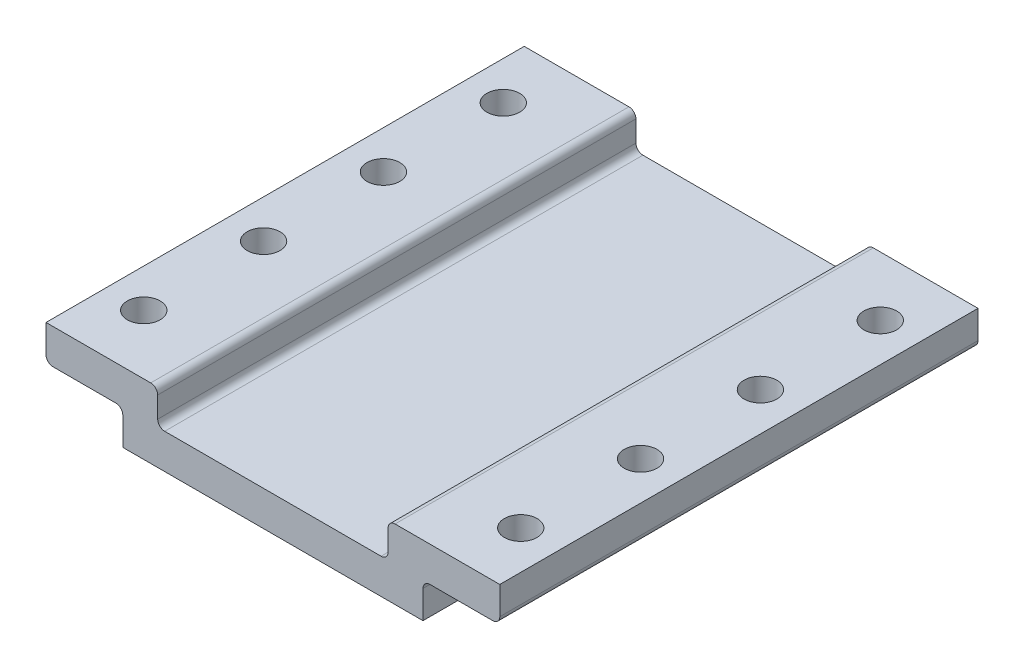
from build123d import *

# Parameters (mm, degrees)
SKETCH1_W           = 43
SKETCH1_H           = 68.5
BOSS_EXTRUDE1_DEPTH = 5
SKETCH2_W           = 16
SKETCH2_H           = 68.5
BOSS_EXTRUDE2_DEPTH = 5
CUT_EXTRUDE1_REACH  = 62.855
SKETCH3_R           = 2.35
FILLET1_R           = 1
CHAMFER1_SIZE       = 1


with BuildPart() as part:
    # Sketch1 → Boss-Extrude1 (new body)
    with BuildSketch(Plane(origin=(0, 0, 0), x_dir=(1, 0, 0), z_dir=(0, 1, 0))):
        with Locations((8.893910561, -17.51450999)):
            Rectangle(SKETCH1_W, SKETCH1_H)
    extrude(amount=BOSS_EXTRUDE1_DEPTH)

    # Sketch2 → Boss-Extrude2 (add)
    with BuildSketch(Plane(origin=(0, 5, 0), x_dir=(1, 0, 0), z_dir=(0, 1, 0))):
        with Locations((-15.606089439, -17.51450999)):
            Rectangle(SKETCH2_W, SKETCH2_H)
    boss_extrude2 = extrude(amount=BOSS_EXTRUDE2_DEPTH)

    # Sketch3 → Cut-Extrude1 (cut, up to next)
    with BuildSketch(Plane(origin=(0, 10, 0), x_dir=(1, 0, 0), z_dir=(0, 1, 0)), mode=Mode.PRIVATE) as cut_extrude1_sk1:
        with Locations(Location((-18.106089439, 8.23549001, 0), (0, 0, 270))):
            Circle(SKETCH3_R)
    cut_extrude1_tool1 = extrude(cut_extrude1_sk1.sketch, amount=-CUT_EXTRUDE1_REACH, mode=Mode.PRIVATE) & part.part
    # Sketch3 → Cut-Extrude1 (cut, up to next)
    with BuildSketch(Plane(origin=(0, 10, 0), x_dir=(1, 0, 0), z_dir=(0, 1, 0)), mode=Mode.PRIVATE) as cut_extrude1_sk2:
        with Locations(Location((-18.106089439, -8.931176657, 0), (0, 0, 270))):
            Circle(SKETCH3_R)
    cut_extrude1_tool2 = extrude(cut_extrude1_sk2.sketch, amount=-CUT_EXTRUDE1_REACH, mode=Mode.PRIVATE) & part.part
    # Sketch3 → Cut-Extrude1 (cut, up to next)
    with BuildSketch(Plane(origin=(0, 10, 0), x_dir=(1, 0, 0), z_dir=(0, 1, 0)), mode=Mode.PRIVATE) as cut_extrude1_sk3:
        with Locations(Location((-18.106089439, -26.097843324, 0), (0, 0, 270))):
            Circle(SKETCH3_R)
    cut_extrude1_tool3 = extrude(cut_extrude1_sk3.sketch, amount=-CUT_EXTRUDE1_REACH, mode=Mode.PRIVATE) & part.part
    # Sketch3 → Cut-Extrude1 (cut, up to next)
    with BuildSketch(Plane(origin=(0, 10, 0), x_dir=(1, 0, 0), z_dir=(0, 1, 0)), mode=Mode.PRIVATE) as cut_extrude1_sk4:
        with Locations(Location((-18.106089439, -43.26450999, 0), (0, 0, 270))):
            Circle(SKETCH3_R)
    cut_extrude1_tool4 = extrude(cut_extrude1_sk4.sketch, amount=-CUT_EXTRUDE1_REACH, mode=Mode.PRIVATE) & part.part
    cut_extrude1_1 = cut_extrude1_tool1.solids().sort_by_distance((-18.106089, 10, -8.23549))[0]
    add(cut_extrude1_1, mode=Mode.SUBTRACT)
    cut_extrude1_2 = cut_extrude1_tool2.solids().sort_by_distance((-18.106089, 10, 8.931177))[0]
    add(cut_extrude1_2, mode=Mode.SUBTRACT)
    cut_extrude1_3 = cut_extrude1_tool3.solids().sort_by_distance((-18.106089, 10, 26.097843))[0]
    add(cut_extrude1_3, mode=Mode.SUBTRACT)
    cut_extrude1_4 = cut_extrude1_tool4.solids().sort_by_distance((-18.106089, 10, 43.26451))[0]
    add(cut_extrude1_4, mode=Mode.SUBTRACT)
    cut_extrude1 = cut_extrude1_1 + cut_extrude1_2 + cut_extrude1_3 + cut_extrude1_4  # Cut-Extrude1 as one shape, for the pattern or mirror that repeats it

    # Mirror1: Boss-Extrude2, Cut-Extrude1 across plane
    add(boss_extrude2.mirror(Plane(origin=(8.893910561, 0, 0), x_dir=(0, 0, 1), z_dir=(1, 0, 0))))
    add(cut_extrude1.mirror(Plane(origin=(8.893910561, 0, 0), x_dir=(0, 0, 1), z_dir=(1, 0, 0))), mode=Mode.SUBTRACT)

    # Fillet1
    fillet1_edges = [part.edges().sort_by_distance(p)[0] for p in [
        (30.393910561, 5, 17.51450999),
        (-7.606089439, 5, 17.51450999),
        (-23.606089439, 5, 17.51450999),
        (-7.606089439, 10, 17.51450999),
        (41.393910561, 5, 17.51450999),
        (25.393910561, 10, 17.51450999),
        (-12.606089439, 5, 17.51450999),
        (25.393910561, 5, 17.51450999),
    ]]
    fillet(fillet1_edges, radius=FILLET1_R)

    # Chamfer1
    chamfer1_edges = [part.edges().sort_by_distance(p)[0] for p in [
        (-18.106089439, 5, -10.58549001),
        (-18.106089439, 5, 6.581176657),
        (-18.106089439, 5, 23.747843324),
        (-18.106089439, 5, 40.91450999),
        (35.893910561, 5, -10.58549001),
        (35.893910561, 5, 6.581176657),
        (35.893910561, 5, 23.747843324),
        (35.893910561, 5, 40.91450999),
    ]]
    chamfer(chamfer1_edges, length=CHAMFER1_SIZE)


solid = part.part
